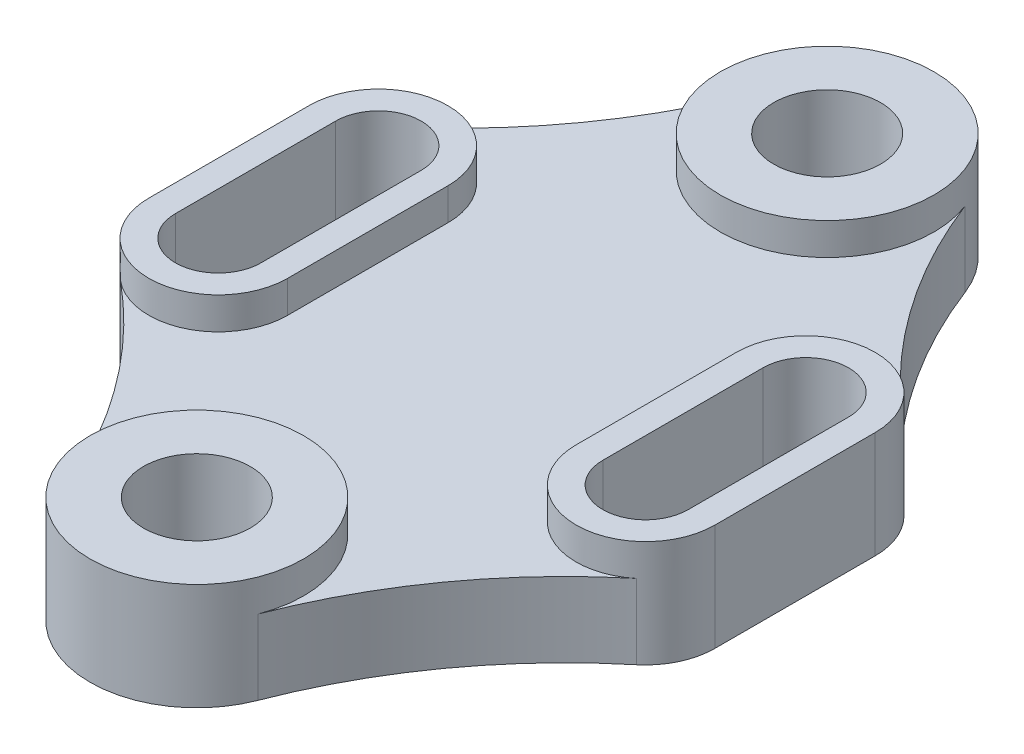
from build123d import *

# Parameters (mm, degrees)
BOSS_EXTRUDE1_DEPTH = 14
SKETCH1_3_R         = 20
SKETCH1_3_R_2       = 10
BOSS_EXTRUDE2_DEPTH = 20


with BuildPart() as part:
    # Sketch1 → Boss-Extrude1 (new body)
    with BuildSketch(Plane(origin=(0, 0, 0), x_dir=(1, 0, 0), z_dir=(0, 1, 0))):
        with BuildLine():
            ThreePointArc((48.282498705, -25.019990778), (34.462513349, -26.76164281), (27, -15))
            Line((27, -15), (27, 15))
            ThreePointArc((27, 15), (34.462513349, 26.76164281), (48.282498705, 25.019990778))
            ThreePointArc((48.282498705, 25.019990778), (30.821521428, 43.692867837), (18.665671202, 66.182807153))
            ThreePointArc((18.665671202, 66.182807153), (19.663588483, 62.652846559), (20, 59))
            ThreePointArc((20, 59), (-3.652846559, 39.336411517), (-18.665671202, 66.182807153))
            ThreePointArc((-18.665671202, 66.182807153), (-30.821521428, 43.692867837), (-48.282498705, 25.019990778))
            ThreePointArc((-48.282498705, 25.019990778), (-34.462513349, 26.76164281), (-27, 15))
            Line((-27, 15), (-27, -15))
            ThreePointArc((-27, -15), (-34.462513349, -26.76164281), (-48.282498705, -25.019990778))
            ThreePointArc((-48.282498705, -25.019990778), (-30.821521428, -43.692867837), (-18.665671202, -66.182807153))
            ThreePointArc((-18.665671202, -66.182807153), (-3.652846559, -39.336411517), (20, -59))
            ThreePointArc((20, -59), (19.663588483, -62.652846559), (18.665671202, -66.182807153))
            ThreePointArc((18.665671202, -66.182807153), (30.821521428, -43.692867837), (48.282498705, -25.019990778))
        make_face()
    extrude(amount=BOSS_EXTRUDE1_DEPTH)

    # Sketch1<3> → Boss-Extrude2 (add)
    # profile 1 of 4: a face of its own
    with BuildSketch(Plane(origin=(0, 0, 0), x_dir=(1, 0, 0), z_dir=(0, 1, 0))):
        with BuildLine():
            Line((27, 15), (27, -15))
            ThreePointArc((27, -15), (40, -28), (53, -15))
            Line((53, -15), (53, 15))
            ThreePointArc((53, 15), (40, 28), (27, 15))
        make_face()
        with BuildLine():
            ThreePointArc((48, -15), (40, -23), (32, -15))
            Line((32, -15), (32, 15))
            ThreePointArc((32, 15), (40, 23), (48, 15))
            Line((48, 15), (48, -15))
        make_face(mode=Mode.SUBTRACT)
    # profile 2 of 4: a face of its own
    with BuildSketch(Plane(origin=(0, 0, 0), x_dir=(1, 0, 0), z_dir=(0, 1, 0))):
        with Locations((0, -59)):
            Circle(SKETCH1_3_R)
        with Locations((0, -59)):
            Circle(SKETCH1_3_R_2, mode=Mode.SUBTRACT)
    # profile 3 of 4: a face of its own
    with BuildSketch(Plane(origin=(0, 0, 0), x_dir=(1, 0, 0), z_dir=(0, 1, 0))):
        with Locations((0, 59)):
            Circle(SKETCH1_3_R)
        with Locations((0, 59)):
            Circle(SKETCH1_3_R_2, mode=Mode.SUBTRACT)
    # profile 4 of 4: a face of its own
    with BuildSketch(Plane(origin=(0, 0, 0), x_dir=(1, 0, 0), z_dir=(0, 1, 0))):
        with BuildLine():
            ThreePointArc((-53, -15), (-40, -28), (-27, -15))
            Line((-27, -15), (-27, 15))
            ThreePointArc((-27, 15), (-40, 28), (-53, 15))
            Line((-53, 15), (-53, -15))
        make_face()
        with BuildLine():
            ThreePointArc((-32, -15), (-40, -23), (-48, -15))
            Line((-48, -15), (-48, 15))
            ThreePointArc((-48, 15), (-40, 23), (-32, 15))
            Line((-32, 15), (-32, -15))
        make_face(mode=Mode.SUBTRACT)
    extrude(amount=BOSS_EXTRUDE2_DEPTH)


solid = part.part
